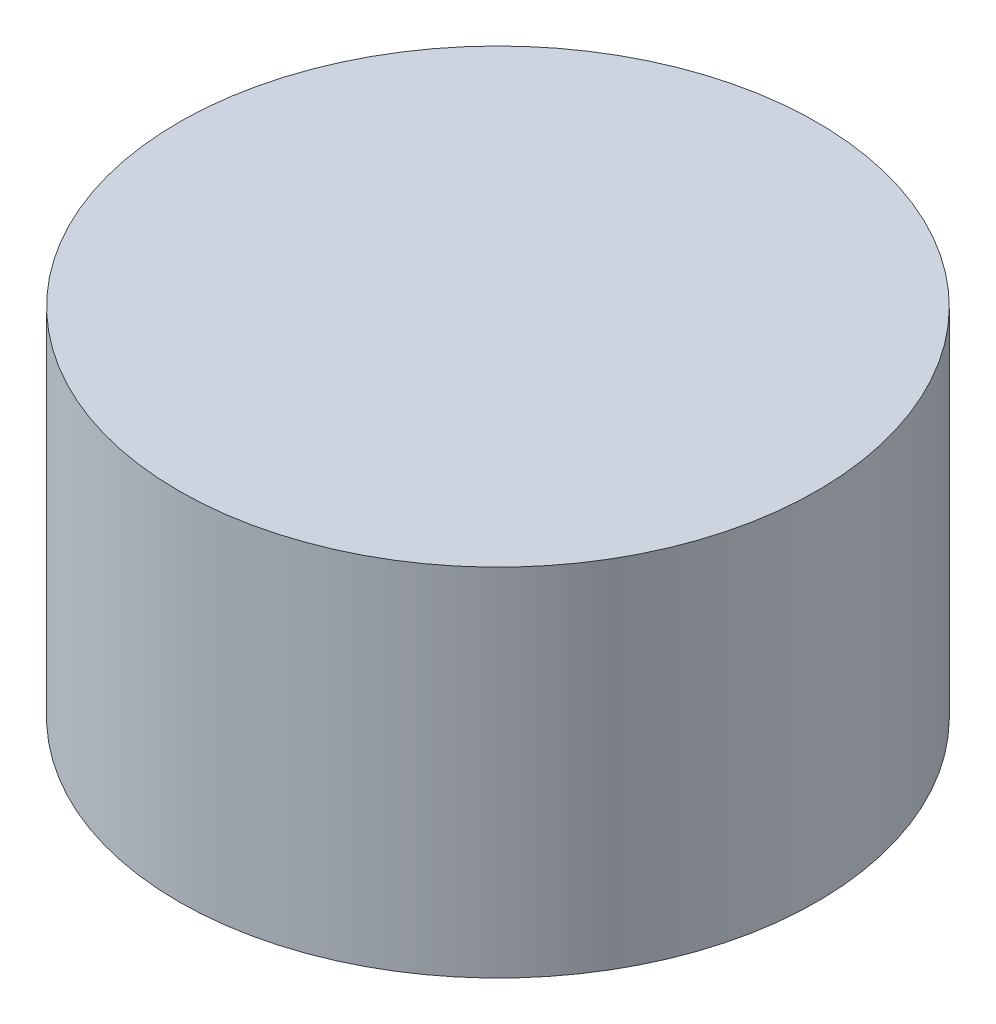
from build123d import *

# Parameters (mm, degrees)
SCHIZZO1_R                   = 14.5
ESTRUSIONE_ESTRUSIONE1_DEPTH = 16.167241511


with BuildPart() as part:
    # Schizzo1 → Estrusione-Estrusione1 (new body)
    with BuildSketch(Plane(origin=(0, 0, 0), x_dir=(1, 0, 0), z_dir=(0, 1, 0))):
        with Locations(Location((0, 0, 0), (0, 0, 270))):
            Circle(SCHIZZO1_R)
    extrude(amount=ESTRUSIONE_ESTRUSIONE1_DEPTH)


solid = part.part
